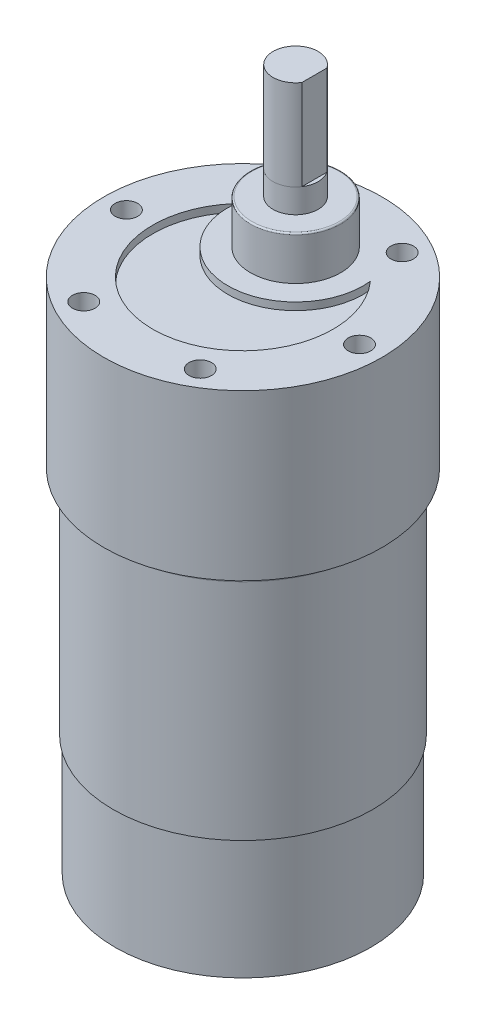
from build123d import *

# Parameters (mm, degrees)
CROQUIS1_R              = 17.25
SALIENTE_EXTRUIR1_DEPTH = 30.8
REDONDEO1_R             = 1
CROQUIS2_R              = 18.5
SALIENTE_EXTRUIR2_DEPTH = 21.9
CROQUIS3_R              = 6
SALIENTE_EXTRUIR3_DEPTH = 5.8
REDONDEO2_R             = 0.2
CROQUIS4_R              = 3
SALIENTE_EXTRUIR4_DEPTH = 3.2
SALIENTE_EXTRUIR5_DEPTH = 12
CROQUIS6_R              = 1.5
CORTAR_EXTRUIR1_DEPTH   = 3
CROQUIS7_R              = 17
SALIENTE_EXTRUIR6_DEPTH = 16
CORTAR_EXTRUIR2_DEPTH   = 1


with BuildPart() as part:
    # Croquis1 → Saliente-Extruir1 (new body)
    with BuildSketch(Plane(origin=(0, 0, 0), x_dir=(1, 0, 0), z_dir=(0, 1, 0))):
        with Locations(Location((0, 0, 0), (0, 0, 90))):
            Circle(CROQUIS1_R)
    extrude(amount=SALIENTE_EXTRUIR1_DEPTH)

    # Redondeo1
    redondeo1_edges = [part.edges().sort_by_distance(p)[0] for p in [
        (0, 30.8, 17.25),
    ]]
    fillet(redondeo1_edges, radius=REDONDEO1_R)


with BuildPart() as body_2:
    # Croquis2 → Saliente-Extruir2 (new body)
    with BuildSketch(Plane(origin=(0, 30.8, 0), x_dir=(1, 0, 0), z_dir=(0, 1, 0))):
        with Locations(Location((0, 0, 0), (0, 0, 270))):
            Circle(CROQUIS2_R)
    extrude(amount=SALIENTE_EXTRUIR2_DEPTH)

    # Croquis6 → Cortar-Extruir1 (cut)
    with BuildSketch(Plane(origin=(0, 52.7, 0), x_dir=(1, 0, 0), z_dir=(0, 1, 0))):
        with Locations(Location((15.5, 0, 0), (0, 0, 270))):
            Circle(CROQUIS6_R)
        with Locations(Location((7.75, 13.423393759, 0), (0, 0, 270))):
            Circle(CROQUIS6_R)
        with Locations(Location((7.75, -13.423393759, 0), (0, 0, 90))):
            Circle(CROQUIS6_R)
        with Locations(Location((-7.75, -13.423393759, 0), (0, 0, 270))):
            Circle(CROQUIS6_R)
        with Locations(Location((-15.5, 0, 0), (0, 0, 90))):
            Circle(CROQUIS6_R)
        with Locations(Location((-7.75, 13.423393759, 0), (0, 0, 90))):
            Circle(CROQUIS6_R)
    extrude(amount=-CORTAR_EXTRUIR1_DEPTH, mode=Mode.SUBTRACT)

    # Croquis8 → Cortar-Extruir2 (cut)
    with BuildSketch(Plane(origin=(0, 52.7, 0), x_dir=(1, 0, 0), z_dir=(0, 1, 0))):
        with BuildLine():
            ThreePointArc((-8.94427191, 8), (0, -12), (8.94427191, 8))
            ThreePointArc((8.94427191, 8), (0, -2), (-8.94427191, 8))
        make_face()
    extrude(amount=-CORTAR_EXTRUIR2_DEPTH, mode=Mode.SUBTRACT)


with BuildPart() as body_3:
    # Croquis3 → Saliente-Extruir3 (new body)
    with BuildSketch(Plane(origin=(0, 52.7, 0), x_dir=(1, 0, 0), z_dir=(0, 1, 0))):
        with Locations(Location((0, 7, 0), (0, 0, 270))):
            Circle(CROQUIS3_R)
    extrude(amount=SALIENTE_EXTRUIR3_DEPTH)

    # Redondeo2
    redondeo2_edges = [body_3.edges().sort_by_distance(p)[0] for p in [
        (0, 58.5, -13),
    ]]
    fillet(redondeo2_edges, radius=REDONDEO2_R)


with BuildPart() as body_4:
    # Croquis4 → Saliente-Extruir4 (new body)
    with BuildSketch(Plane(origin=(0, 58.5, 0), x_dir=(1, 0, 0), z_dir=(0, 1, 0))):
        with Locations(Location((0, 7, 0), (0, 0, 270))):
            Circle(CROQUIS4_R)
    extrude(amount=SALIENTE_EXTRUIR4_DEPTH)


with BuildPart() as body_5:
    # Croquis5 → Saliente-Extruir5 (new body)
    with BuildSketch(Plane(origin=(0, 61.7, 0), x_dir=(1, 0, 0), z_dir=(0, 1, 0))):
        with BuildLine():
            Line((2.5, 8.658312395), (2.5, 5.341687605))
            ThreePointArc((2.5, 5.341687605), (-3, 7), (2.5, 8.658312395))
        make_face()
    extrude(amount=SALIENTE_EXTRUIR5_DEPTH)


with BuildPart() as body_6:
    # Croquis7 → Saliente-Extruir6 (new body)
    with BuildSketch(Plane.XZ):
        with Locations(Location((0, 0, 0), (0, 0, 270))):
            Circle(CROQUIS7_R)
    extrude(amount=SALIENTE_EXTRUIR6_DEPTH)


solid = Compound([part.part, body_2.part, body_3.part, body_4.part, body_5.part, body_6.part])
